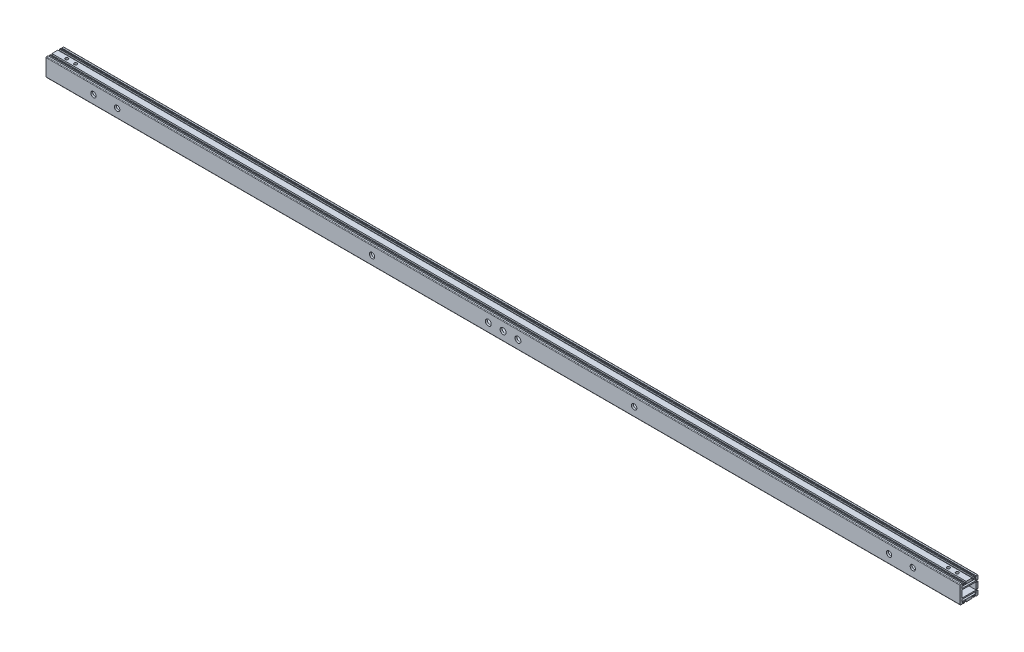
from build123d import *

# Parameters (mm, degrees)
SKETCH_1_W             = 23.5
SKETCH_1_H             = 12
EXTRUDE_1_DEPTH        = 771
HOLE_WIZARD_M6_1_D     = 5
HOLE_WIZARD_M6_1_DEPTH = 15
HOLE_WIZARD_M6_1_TIP   = 1.502151548
HOLE_WIZARD_M6_2_D     = 5
HOLE_WIZARD_M6_2_DEPTH = 15
HOLE_WIZARD_M6_2_TIP   = 1.502151548
SKETCH_7_R             = 4.5
CUT_EXTRUDE_1_DEPTH    = 772.729227126
SKETCH_8_R             = 5
CUT_EXTRUDE_2_DEPTH    = 15
SKETCH_9_R             = 3.5
CUT_EXTRUDE_3_DEPTH    = 15
HOLE_WIZARD_M6_3_D     = 5
HOLE_WIZARD_M6_3_DEPTH = 15
HOLE_WIZARD_M6_3_TIP   = 1.502151548
HOLE_WIZARD_M6_4_D     = 5
HOLE_WIZARD_M6_4_DEPTH = 15
HOLE_WIZARD_M6_4_TIP   = 1.502151548
SKETCH_14_R            = 4.5
CUT_EXTRUDE_4_DEPTH    = 772.729227126


with BuildPart() as part:
    # 草图1 → 凸台-拉伸1 (new, symmetric)
    with BuildSketch(Plane(origin=(0, 0, 0), x_dir=(0, 0, -1), z_dir=(1, 0, 0))):
        with BuildLine():
            Line((-14, 15), (-11.5, 15))
            Line((-11.5, 15), (-11.5, 13.5))
            Line((-11.5, 13.5), (-11.4, 13.5))
            ThreePointArc((-11.4, 13.5), (-11.117157288, 13.382842712), (-11, 13.1))
            Line((-11, 13.1), (-11, 12))
            Line((-11, 12), (-9.5, 12))
            Line((-9.5, 12), (-9.5, 15))
            Line((-9.5, 15), (-8, 15))
            Line((-8, 15), (-8, 12.5))
            Line((-8, 12.5), (-5, 12.5))
            Line((-5, 12.5), (-5, 15))
            Line((-5, 15), (5, 15))
            Line((5, 15), (5, 12.5))
            Line((5, 12.5), (8, 12.5))
            Line((8, 12.5), (8, 15))
            Line((8, 15), (9.5, 15))
            Line((9.5, 15), (9.5, 12))
            Line((9.5, 12), (11, 12))
            Line((11, 12), (11, 13.1))
            ThreePointArc((11, 13.1), (11.117157288, 13.382842712), (11.4, 13.5))
            Line((11.4, 13.5), (11.5, 13.5))
            Line((11.5, 13.5), (11.5, 15))
            Line((11.5, 15), (14, 15))
            ThreePointArc((14, 15), (14.707106781, 14.707106781), (15, 14))
            Line((15, 14), (15, 8))
            Line((15, 8), (12.5, 8))
            Line((12.5, 8), (12.5, 5))
            Line((12.5, 5), (15, 5))
            Line((15, 5), (15, -5))
            Line((15, -5), (12.5, -5))
            Line((12.5, -5), (12.5, -8))
            Line((12.5, -8), (15, -8))
            Line((15, -8), (15, -14))
            ThreePointArc((15, -14), (14.707106781, -14.707106781), (14, -15))
            Line((14, -15), (11.5, -15))
            Line((11.5, -15), (11.5, -13.5))
            Line((11.5, -13.5), (11.4, -13.5))
            ThreePointArc((11.4, -13.5), (11.117157288, -13.382842712), (11, -13.1))
            Line((11, -13.1), (11, -12))
            Line((11, -12), (9.5, -12))
            Line((9.5, -12), (9.5, -15))
            Line((9.5, -15), (8, -15))
            Line((8, -15), (8, -12.5))
            Line((8, -12.5), (5, -12.5))
            Line((5, -12.5), (5, -15))
            Line((5, -15), (-5, -15))
            Line((-5, -15), (-5, -12.5))
            Line((-5, -12.5), (-8, -12.5))
            Line((-8, -12.5), (-8, -15))
            Line((-8, -15), (-9.5, -15))
            Line((-9.5, -15), (-9.5, -12))
            Line((-9.5, -12), (-11, -12))
            Line((-11, -12), (-11, -13.1))
            ThreePointArc((-11, -13.1), (-11.117157288, -13.382842712), (-11.4, -13.5))
            Line((-11.4, -13.5), (-11.5, -13.5))
            Line((-11.5, -13.5), (-11.5, -15))
            Line((-11.5, -15), (-14, -15))
            ThreePointArc((-14, -15), (-14.707106781, -14.707106781), (-15, -14))
            Line((-15, -14), (-15, 14))
            ThreePointArc((-15, 14), (-14.707106781, 14.707106781), (-14, 15))
        make_face()
        with BuildLine():
            Line((12, -10.5), (12, -8.5))
            ThreePointArc((12, -8.5), (11.853553391, -8.146446609), (11.5, -8))
            Line((11.5, -8), (-11.5, -8))
            ThreePointArc((-11.5, -8), (-11.853553391, -8.146446609), (-12, -8.5))
            Line((-12, -8.5), (-12, -10.5))
            ThreePointArc((-12, -10.5), (-11.853553391, -10.853553391), (-11.5, -11))
            Line((-11.5, -11), (11.5, -11))
            ThreePointArc((11.5, -11), (11.853553391, -10.853553391), (12, -10.5))
        make_face(mode=Mode.SUBTRACT)
        with BuildLine():
            Line((-11.5, 11), (11.5, 11))
            ThreePointArc((11.5, 11), (11.853553391, 10.853553391), (12, 10.5))
            Line((12, 10.5), (12, 8.5))
            ThreePointArc((12, 8.5), (11.853553391, 8.146446609), (11.5, 8))
            Line((11.5, 8), (-11.5, 8))
            ThreePointArc((-11.5, 8), (-11.853553391, 8.146446609), (-12, 8.5))
            Line((-12, 8.5), (-12, 10.5))
            ThreePointArc((-12, 10.5), (-11.853553391, 10.853553391), (-11.5, 11))
        make_face(mode=Mode.SUBTRACT)
        Rectangle(SKETCH_1_W, SKETCH_1_H, mode=Mode.SUBTRACT)
    extrude(amount=EXTRUDE_1_DEPTH, both=True)

    # M6 螺纹孔1
    with Locations(Plane(origin=(0, 0, -15), x_dir=(-1, 0, 0), z_dir=(0, 0, -1))):
        with Locations((751, 0), (736, 0), (-736, 0), (-751, 0)):
            Hole(HOLE_WIZARD_M6_1_D / 2, depth=HOLE_WIZARD_M6_1_DEPTH)
            with Locations((0, 0, -(HOLE_WIZARD_M6_1_DEPTH + HOLE_WIZARD_M6_1_TIP / 2))):  # 118° drill point
                Cone(0, HOLE_WIZARD_M6_1_D / 2, HOLE_WIZARD_M6_1_TIP, mode=Mode.SUBTRACT)

    # M6 螺纹孔2
    with Locations(Plane(origin=(0, 15, 0), x_dir=(-1, 0, 0), z_dir=(0, 1, 0))):
        with Locations((-751, 0), (-736, 0), (736, 0), (751, 0)):
            Hole(HOLE_WIZARD_M6_2_D / 2, depth=HOLE_WIZARD_M6_2_DEPTH)
            with Locations((0, 0, -(HOLE_WIZARD_M6_2_DEPTH + HOLE_WIZARD_M6_2_TIP / 2))):  # 118° drill point
                Cone(0, HOLE_WIZARD_M6_2_D / 2, HOLE_WIZARD_M6_2_TIP, mode=Mode.SUBTRACT)

    # 草图7 → 切除-拉伸1 (cut, through all)
    with BuildSketch(Plane.XY.offset(15)):
        with Locations((-651, 0)):
            Circle(SKETCH_7_R)
        with Locations((-221, 0)):
            Circle(SKETCH_7_R)
        with Locations((651, 0)):
            Circle(SKETCH_7_R)
        with Locations((221, 0)):
            Circle(SKETCH_7_R)
    extrude(amount=-CUT_EXTRUDE_1_DEPTH, mode=Mode.SUBTRACT)

    # 草图8 → 切除-拉伸2 (cut)
    with BuildSketch(Plane.XY.offset(15)):
        Circle(SKETCH_8_R)
        with Locations((-25, 0)):
            Circle(SKETCH_8_R)
        with Locations((25, 0)):
            Circle(SKETCH_8_R)
    extrude(amount=-CUT_EXTRUDE_2_DEPTH, mode=Mode.SUBTRACT)

    # 草图9 → 切除-拉伸3 (cut)
    with BuildSketch(Plane(origin=(0, 0, -15), x_dir=(-1, 0, 0), z_dir=(0, 0, -1))):
        Circle(SKETCH_9_R)
        with BuildLine():
            Line((27, 2.5), (27, -2.5))
            ThreePointArc((27, -2.5), (25, -4.5), (23, -2.5))
            Line((23, -2.5), (23, 2.5))
            ThreePointArc((23, 2.5), (25, 4.5), (27, 2.5))
        make_face()
        with BuildLine():
            Line((-27, 2.5), (-27, -2.5))
            ThreePointArc((-27, -2.5), (-25, -4.5), (-23, -2.5))
            Line((-23, -2.5), (-23, 2.5))
            ThreePointArc((-23, 2.5), (-25, 4.5), (-27, 2.5))
        make_face()
    extrude(amount=-CUT_EXTRUDE_3_DEPTH, mode=Mode.SUBTRACT)

    # M6 螺纹孔3
    with Locations(Plane(origin=(0, 0, -15), x_dir=(-1, 0, 0), z_dir=(0, 0, -1))):
        with Locations((411, 0), (351, 0), (321, 0), (261, 0), (-261, 0), (-321, 0), (-351, 0), (-411, 0)):
            Hole(HOLE_WIZARD_M6_3_D / 2, depth=HOLE_WIZARD_M6_3_DEPTH)
            with Locations((0, 0, -(HOLE_WIZARD_M6_3_DEPTH + HOLE_WIZARD_M6_3_TIP / 2))):  # 118° drill point
                Cone(0, HOLE_WIZARD_M6_3_D / 2, HOLE_WIZARD_M6_3_TIP, mode=Mode.SUBTRACT)

    # M6 螺纹孔4
    with Locations(Plane(origin=(0, 0, -15), x_dir=(-1, 0, 0), z_dir=(0, 0, -1))):
        with Locations((691, 0), (-691, 0)):
            Hole(HOLE_WIZARD_M6_4_D / 2, depth=HOLE_WIZARD_M6_4_DEPTH)
            with Locations((0, 0, -(HOLE_WIZARD_M6_4_DEPTH + HOLE_WIZARD_M6_4_TIP / 2))):  # 118° drill point
                Cone(0, HOLE_WIZARD_M6_4_D / 2, HOLE_WIZARD_M6_4_TIP, mode=Mode.SUBTRACT)

    # 草图14 → 切除-拉伸4 (cut, through all)
    with BuildSketch(Plane(origin=(0, 0, -15), x_dir=(-1, 0, 0), z_dir=(0, 0, -1))):
        with Locations((691, 0)):
            Circle(SKETCH_14_R)
        with Locations((-691, 0)):
            Circle(SKETCH_14_R)
    extrude(amount=-CUT_EXTRUDE_4_DEPTH, mode=Mode.SUBTRACT)


solid = part.part
